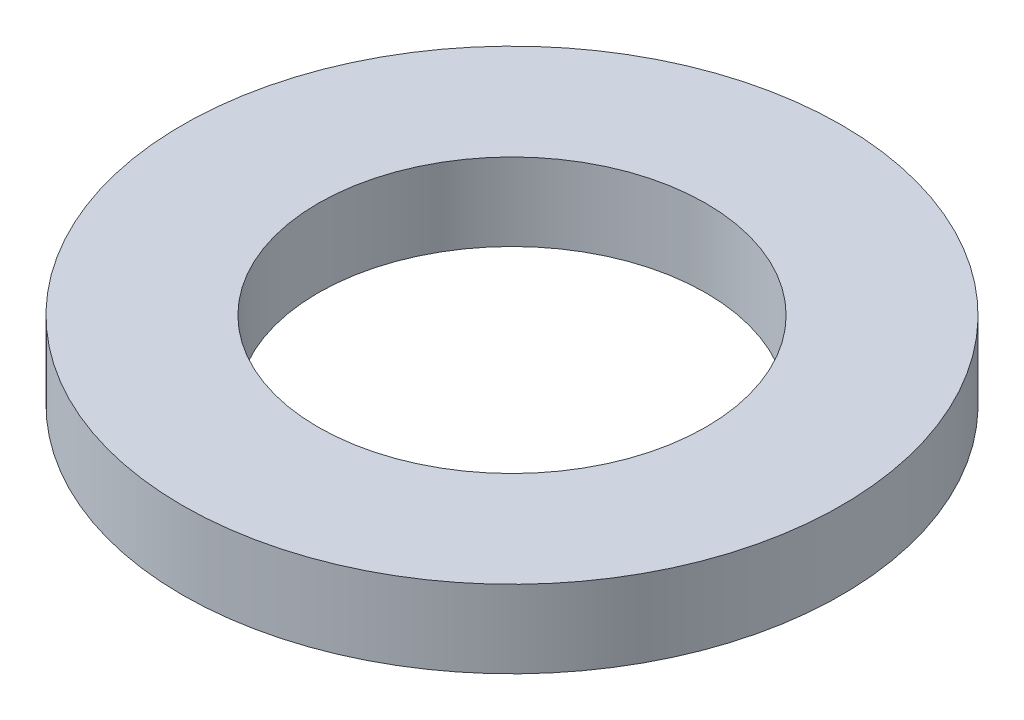
from build123d import *

# Parameters (mm, degrees)
SKETCH_1_R      = 12.75
SKETCH_1_R_2    = 7.5
EXTRUDE_1_DEPTH = 3


with BuildPart() as part:
    # 스케치1 → 보스-돌출1 (new body)
    with BuildSketch(Plane(origin=(0, 0, 0), x_dir=(1, 0, 0), z_dir=(0, 1, 0))):
        with Locations(Location((0, 0, 0), (0, 0, 270))):
            Circle(SKETCH_1_R)
        with Locations(Location((0, 0, 0), (0, 0, 270))):
            Circle(SKETCH_1_R_2, mode=Mode.SUBTRACT)
    extrude(amount=EXTRUDE_1_DEPTH)


solid = part.part
